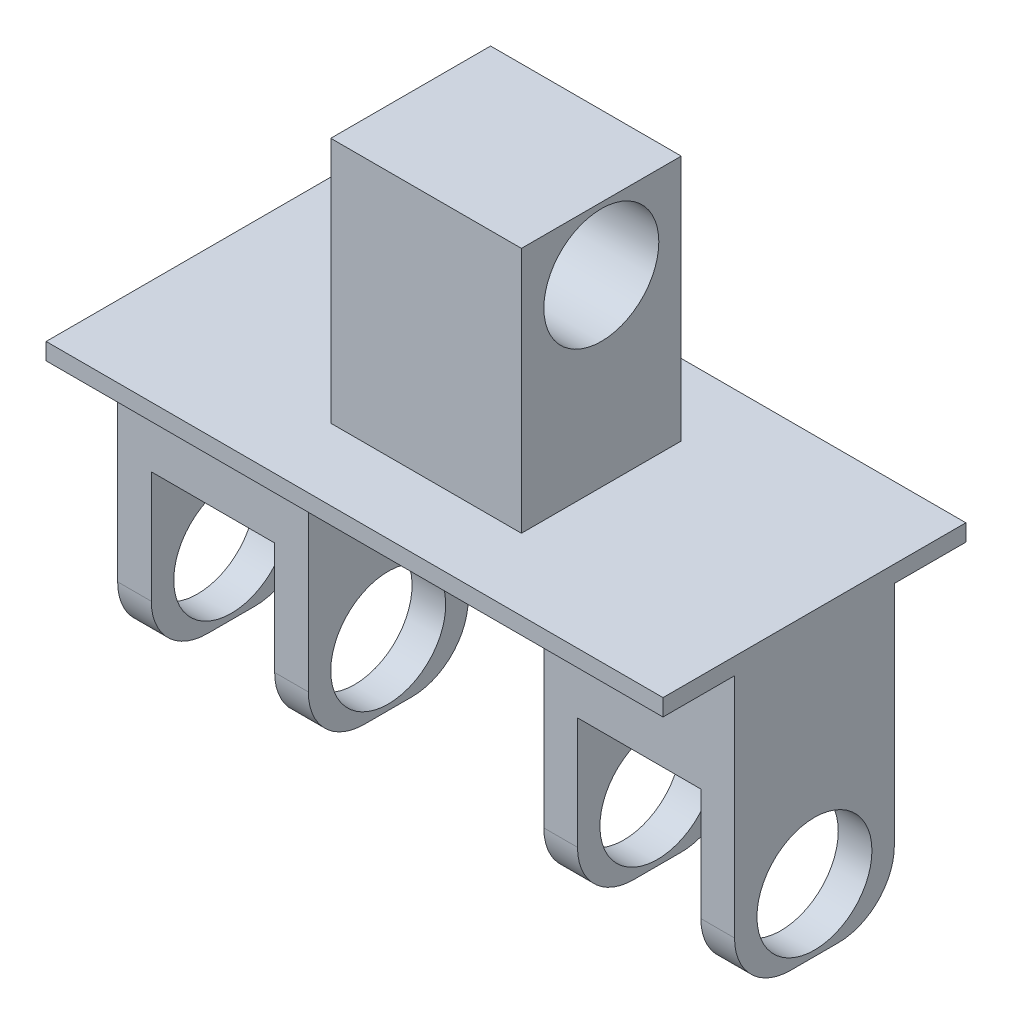
from build123d import *

# Parameters (mm, degrees)
SKETCH1_W               = 110
SKETCH1_H               = 54
BOSS_EXTRUDE1_DEPTH     = 3
SKETCH2_W               = 34
SKETCH2_H               = 28.5
BOSS_EXTRUDE2_DEPTH     = 50.5
CUT_EXTRUDE1_DEPTH      = 125.013104146
CUT_EXTRUDE1_DEPTH_BACK = 125.013104146
SKETCH3_R               = 10.25
CUT_EXTRUDE2_DEPTH      = 86.304234948
CUT_EXTRUDE2_DEPTH_BACK = 86.304234948
SKETCH4_W               = 22
SKETCH4_H               = 30
FILLET1_R               = 10
SKETCH5_W               = 34
SKETCH5_H               = 28.5
BOSS_EXTRUDE3_DEPTH     = 44
CUT_EXTRUDE3_DEPTH      = 92.995923823
CUT_EXTRUDE3_DEPTH_BACK = 92.995923823
SKETCH6_R               = 10.25


with BuildPart() as part:
    # Sketch1 → Boss-Extrude1 (new body)
    with BuildSketch(Plane(origin=(0, 0, 0), x_dir=(1, 0, 0), z_dir=(0, 1, 0))):
        Rectangle(SKETCH1_W, SKETCH1_H)
    extrude(amount=BOSS_EXTRUDE1_DEPTH)

    # Sketch2 → Boss-Extrude2 (add)
    with BuildSketch(Plane.XZ):
        with Locations((38, 0)):
            Rectangle(SKETCH2_W, SKETCH2_H)
        with Locations((-38, 0)):
            Rectangle(SKETCH2_W, SKETCH2_H)
    extrude(amount=BOSS_EXTRUDE2_DEPTH)

    # Sketch3 → Cut-Extrude1 (cut, two sides: drawn at the far end of the back side and taken through both)
    with BuildSketch(Plane(origin=(55, 0, 0), x_dir=(0, 0, -1), z_dir=(1, 0, 0)).offset(-CUT_EXTRUDE1_DEPTH_BACK)):
        with Locations((0, -39.25)):
            Circle(SKETCH3_R)
    extrude(amount=CUT_EXTRUDE1_DEPTH + CUT_EXTRUDE1_DEPTH_BACK, mode=Mode.SUBTRACT)

    # Sketch4 → Cut-Extrude2 (cut, two sides: drawn at the far end of the back side and taken through both)
    with BuildSketch(Plane.XY.offset(14.25).offset(-CUT_EXTRUDE2_DEPTH_BACK)):
        with Locations((38, -35.5)):
            Rectangle(SKETCH4_W, SKETCH4_H)
        with Locations((-38, -35.5)):
            Rectangle(SKETCH4_W, SKETCH4_H)
    extrude(amount=CUT_EXTRUDE2_DEPTH + CUT_EXTRUDE2_DEPTH_BACK, mode=Mode.SUBTRACT)

    # Fillet1
    fillet1_edges = [part.edges().sort_by_distance(p)[0] for p in [
        (52, -50.5, 14.25),
        (24, -50.5, -14.25),
        (-24, -50.5, 14.25),
        (-52, -50.5, -14.25),
        (-52, -50.5, 14.25),
        (-24, -50.5, -14.25),
        (24, -50.5, 14.25),
        (52, -50.5, -14.25),
    ]]
    fillet(fillet1_edges, radius=FILLET1_R)

    # Sketch5 → Boss-Extrude3 (add)
    with BuildSketch(Plane(origin=(0, 3, 0), x_dir=(1, 0, 0), z_dir=(0, 1, 0))):
        Rectangle(SKETCH5_W, SKETCH5_H)
    extrude(amount=BOSS_EXTRUDE3_DEPTH)

    # Sketch6 → Cut-Extrude3 (cut, two sides: drawn at the far end of the back side and taken through both)
    with BuildSketch(Plane(origin=(17, 0, 0), x_dir=(0, 0, -1), z_dir=(1, 0, 0)).offset(-CUT_EXTRUDE3_DEPTH_BACK)):
        with Locations((0, 35.75)):
            Circle(SKETCH6_R)
    extrude(amount=CUT_EXTRUDE3_DEPTH + CUT_EXTRUDE3_DEPTH_BACK, mode=Mode.SUBTRACT)


solid = part.part
